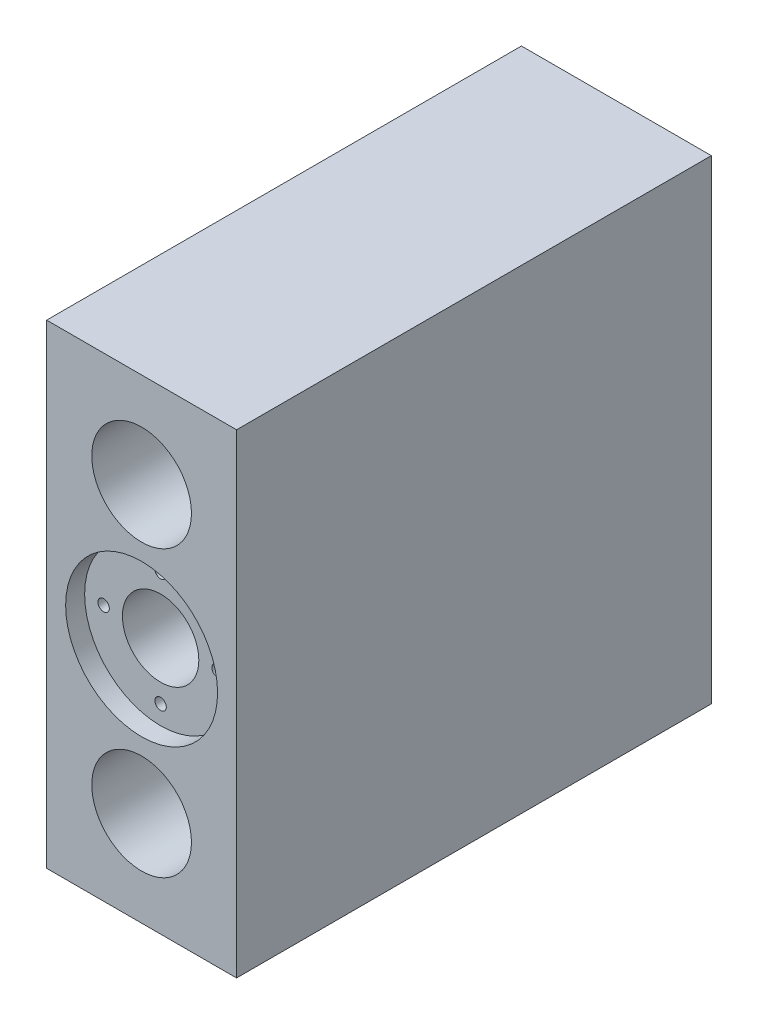
from build123d import *

# Parameters (mm, degrees)
SKETCH2_W           = 40
SKETCH2_H           = 100
SKETCH2_R           = 5.5
SKETCH2_R_2         = 10.5
BOSS_EXTRUDE1_DEPTH = 100
SKETCH3_R           = 16
CUT_EXTRUDE1_DEPTH  = 4
SKETCH4_R           = 8.05
CUT_EXTRUDE2_DEPTH  = 16
SKETCH5_R           = 1.2
CUT_EXTRUDE3_DEPTH  = 15
CUT_EXTRUDE4_START  = -4
SKETCH6_R           = 16
CUT_EXTRUDE4_DEPTH  = 4
CUT_EXTRUDE5_START  = -16
SKETCH7_R           = 8.05
CUT_EXTRUDE5_DEPTH  = 16
CUT_EXTRUDE6_START  = -15
SKETCH8_R           = 1.2
CUT_EXTRUDE6_DEPTH  = 15


with BuildPart() as part:
    # Sketch2 → Boss-Extrude1 (new body)
    with BuildSketch(Plane.XY):
        with Locations((20, -50)):
            Rectangle(SKETCH2_W, SKETCH2_H)
        with Locations((20, -50)):
            Circle(SKETCH2_R, mode=Mode.SUBTRACT)
        with Locations((20, -20)):
            Circle(SKETCH2_R_2, mode=Mode.SUBTRACT)
        with Locations((20, -80)):
            Circle(SKETCH2_R_2, mode=Mode.SUBTRACT)
    extrude(amount=BOSS_EXTRUDE1_DEPTH)

    # Sketch3 → Cut-Extrude1 (cut)
    with BuildSketch(Plane.XY.offset(100)):
        with Locations((20, -50)):
            Circle(SKETCH3_R)
    extrude(amount=-CUT_EXTRUDE1_DEPTH, mode=Mode.SUBTRACT)

    # Sketch4 → Cut-Extrude2 (cut)
    with BuildSketch(Plane.XY.offset(96)):
        with Locations((20, -50)):
            Circle(SKETCH4_R)
    extrude(amount=-CUT_EXTRUDE2_DEPTH, mode=Mode.SUBTRACT)

    # Sketch5 → Cut-Extrude3 (cut)
    with BuildSketch(Plane.XY.offset(96)):
        with Locations((20, -38)):
            Circle(SKETCH5_R)
        with Locations((8, -50)):
            Circle(SKETCH5_R)
        with Locations((32, -50)):
            Circle(SKETCH5_R)
        with Locations((20, -62)):
            Circle(SKETCH5_R)
    extrude(amount=-CUT_EXTRUDE3_DEPTH, mode=Mode.SUBTRACT)

    # Sketch6 → Cut-Extrude4 (cut)
    with BuildSketch(Plane(origin=(0, 0, 0), x_dir=(-1, 0, 0), z_dir=(0, 0, -1)).offset(CUT_EXTRUDE4_START)):
        with Locations(Location((-20, -50, 0), (0, 0, 180))):
            Circle(SKETCH6_R)
    extrude(amount=CUT_EXTRUDE4_DEPTH, mode=Mode.SUBTRACT)

    # Sketch7 → Cut-Extrude5 (cut)
    with BuildSketch(Plane(origin=(0, 0, 4), x_dir=(-1, 0, 0), z_dir=(0, 0, -1)).offset(CUT_EXTRUDE5_START)):
        with Locations(Location((-20, -50, 0), (0, 0, 180))):
            Circle(SKETCH7_R)
    extrude(amount=CUT_EXTRUDE5_DEPTH, mode=Mode.SUBTRACT)

    # Sketch8 → Cut-Extrude6 (cut)
    with BuildSketch(Plane(origin=(0, 0, 4), x_dir=(-1, 0, 0), z_dir=(0, 0, -1)).offset(CUT_EXTRUDE6_START)):
        with Locations(Location((-20, -62, 0), (0, 0, 180))):
            Circle(SKETCH8_R)
        with Locations(Location((-32, -50, 0), (0, 0, 180))):
            Circle(SKETCH8_R)
        with Locations(Location((-8, -50, 0), (0, 0, 180))):
            Circle(SKETCH8_R)
        with Locations(Location((-20, -38, 0), (0, 0, 180))):
            Circle(SKETCH8_R)
    extrude(amount=CUT_EXTRUDE6_DEPTH, mode=Mode.SUBTRACT)


solid = part.part
